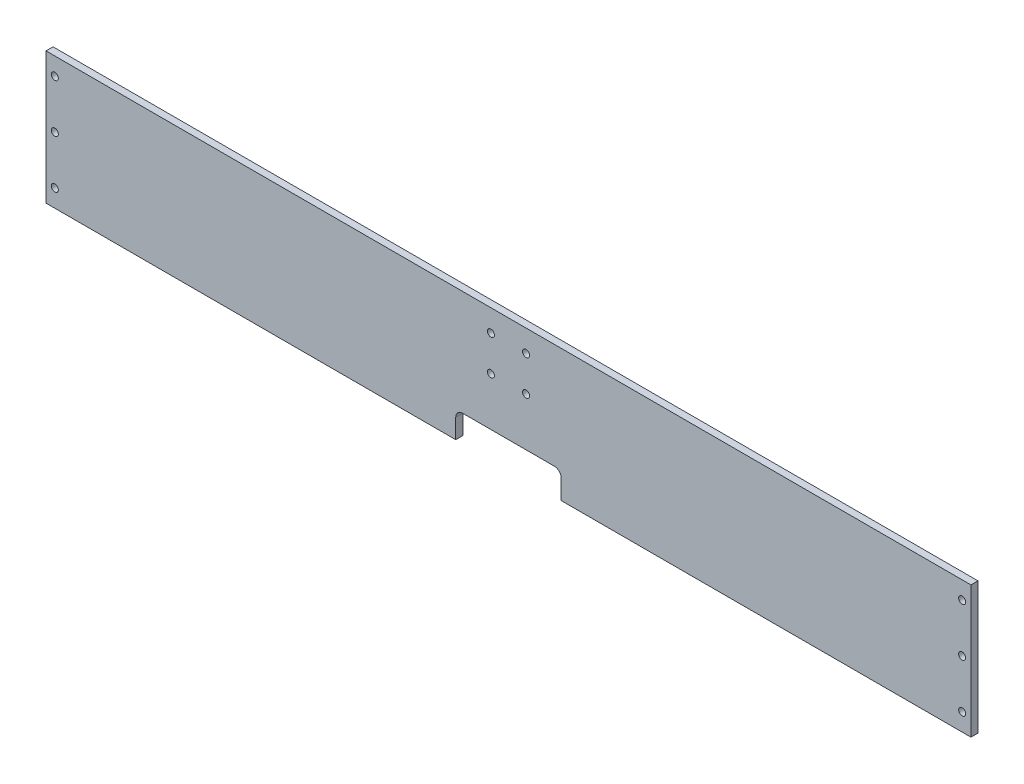
from build123d import *

# Parameters (mm, degrees)
SCHIZZO1_W                   = 526
SCHIZZO1_H                   = 75
SCHIZZO1_R                   = 2
ESTRUSIONE_ESTRUSIONE1_DEPTH = 4
SCHIZZO2_R                   = 2
TAGLIO_ESTRUSIONE1_DEPTH     = 4


with BuildPart() as part:
    # Schizzo1 → Estrusione-Estrusione1 (new body)
    with BuildSketch(Plane.XY):
        with Locations((263, 37.5)):
            Rectangle(SCHIZZO1_W, SCHIZZO1_H)
        with Locations((5, 37.5)):
            Circle(SCHIZZO1_R, mode=Mode.SUBTRACT)
        with Locations((5, 65)):
            Circle(SCHIZZO1_R, mode=Mode.SUBTRACT)
        with Locations(Location((5, 10, 0), (0, 0, 180))):
            Circle(SCHIZZO1_R, mode=Mode.SUBTRACT)
        with Locations((521, 10)):
            Circle(SCHIZZO1_R, mode=Mode.SUBTRACT)
        with Locations(Location((521, 65, 0), (0, 0, 180))):
            Circle(SCHIZZO1_R, mode=Mode.SUBTRACT)
        with Locations(Location((521, 37.5, 0), (0, 0, 180))):
            Circle(SCHIZZO1_R, mode=Mode.SUBTRACT)
    extrude(amount=-ESTRUSIONE_ESTRUSIONE1_DEPTH)

    # Schizzo2 → Taglio-Estrusione1 (cut)
    with BuildSketch(Plane.XY):
        with Locations((253, 62.5)):
            Circle(SCHIZZO2_R)
        with Locations(Location((273, 62.5, 0), (0, 0, 180))):
            Circle(SCHIZZO2_R)
        with Locations((253, 42.5)):
            Circle(SCHIZZO2_R)
        with Locations((273, 42.5)):
            Circle(SCHIZZO2_R)
        with BuildLine():
            Line((293, -15), (293, 11))
            ThreePointArc((293, 11), (291.828427125, 13.828427125), (289, 15))
            Line((289, 15), (237, 15))
            ThreePointArc((237, 15), (234.171572875, 13.828427125), (233, 11))
            Line((233, 11), (233, -15))
            Line((233, -15), (293, -15))
        make_face()
    extrude(amount=-TAGLIO_ESTRUSIONE1_DEPTH, mode=Mode.SUBTRACT)


solid = part.part
